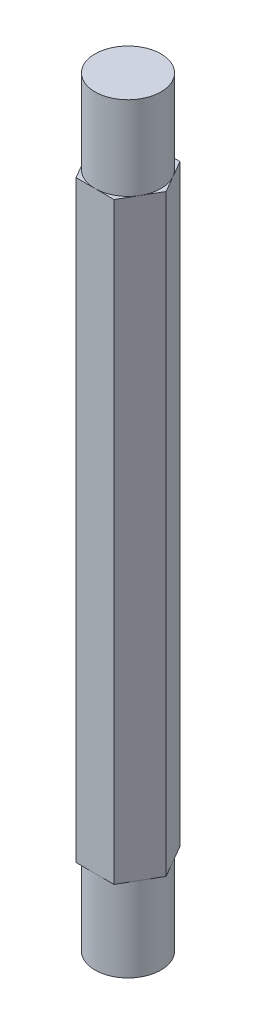
from build123d import *

# Parameters (mm, degrees)
BOSS_EXTRUDE1_DEPTH = 57.699999944
CUT_EXTRUDE1_DEPTH  = 6.35


with BuildPart() as part:
    # Sketch1 → Boss-Extrude1 (new body)
    with BuildSketch(Plane(origin=(0, 0, 0), x_dir=(1, 0, 0), z_dir=(0, 1, 0))):
        Polygon((2.886751346, 0), (1.443375673, 2.5), (-1.443375673, 2.5), (-2.886751346, 0), (-1.443375673, -2.5), (1.443375673, -2.5), align=None)
    extrude(amount=BOSS_EXTRUDE1_DEPTH)

    # Sketch2 → Cut-Extrude1 (cut)
    with BuildSketch(Plane(origin=(0, 0, 0), x_dir=(-1, 0, 0), z_dir=(0, -1, 0))):
        with BuildLine():
            Line((-2.16506344, -1.25000012), (-1.443375673, -2.5))
            Line((-1.443375673, -2.5), (0, -2.5))
            ThreePointArc((0, -2.5), (-1.24999994, -2.165063544), (-2.16506344, -1.25000012))
        make_face()
        with BuildLine():
            Line((0, -2.5), (1.443375673, -2.5))
            Line((1.443375673, -2.5), (2.165063522, -1.249999979))
            ThreePointArc((2.165063522, -1.249999979), (1.250000011, -2.165063503), (0, -2.5))
        make_face()
        with BuildLine():
            Line((2.165063522, -1.249999979), (2.886751346, 0))
            Line((2.886751346, 0), (2.165063508, 1.250000002))
            ThreePointArc((2.165063508, 1.250000002), (2.414814565, 0.647047614), (2.5, 0))
            ThreePointArc((2.5, 0), (2.414814569, -0.647047601), (2.165063522, -1.249999979))
        make_face()
        with BuildLine():
            Line((2.165063508, 1.250000002), (1.443375673, 2.5))
            Line((1.443375673, 2.5), (0, 2.5))
            ThreePointArc((0, 2.5), (1.249999999, 2.16506351), (2.165063508, 1.250000002))
        make_face()
        with BuildLine():
            Line((-2.165063434, 1.25000013), (-2.886751346, 0))
            Line((-2.886751346, 0), (-2.16506344, -1.25000012))
            ThreePointArc((-2.16506344, -1.25000012), (-2.5, 6e-09), (-2.165063434, 1.25000013))
        make_face()
        with BuildLine():
            Line((0, 2.5), (-1.443375673, 2.5))
            Line((-1.443375673, 2.5), (-2.165063434, 1.25000013))
            ThreePointArc((-2.165063434, 1.25000013), (-1.249999935, 2.165063547), (0, 2.5))
        make_face()
    cut_extrude1 = extrude(amount=-CUT_EXTRUDE1_DEPTH, mode=Mode.SUBTRACT)

    # Mirror1: Cut-Extrude1 across plane
    add(cut_extrude1.mirror(Plane(origin=(0, 28.849999972, 0), x_dir=(0, 0, 1), z_dir=(0, -1, 0))), mode=Mode.SUBTRACT)


solid = part.part
